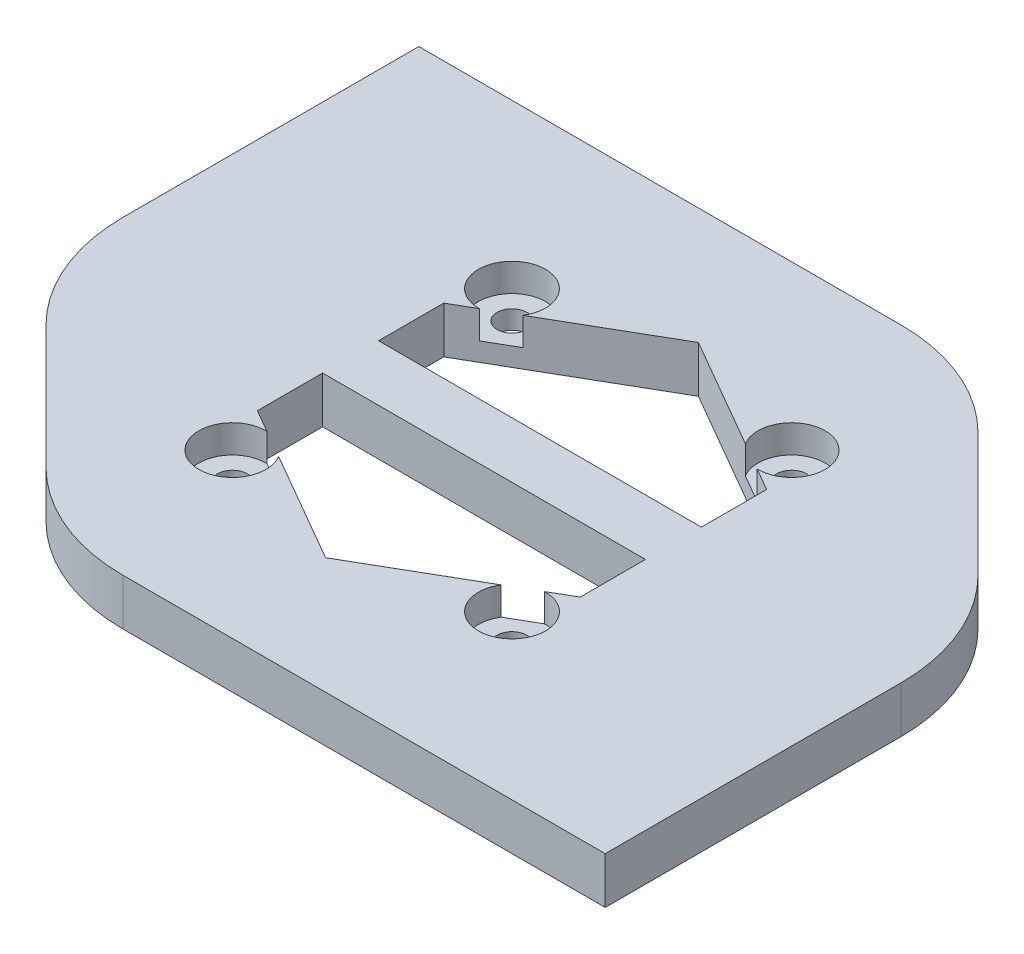
from build123d import *

# Parameters (mm, degrees)
SKETCH1_W           = 85
SKETCH1_H           = 65
BOSS_EXTRUDE1_DEPTH = 5
CUT_EXTRUDE1_DEPTH  = 46
CUT_EXTRUDE2_DEPTH  = 46
SKETCH5_W           = 45.682853102
SKETCH5_H           = 6
BOSS_EXTRUDE3_DEPTH = 5
SKETCH6_R           = 3.6
CUT_EXTRUDE3_DEPTH  = 3
CUT_EXTRUDE4_DEPTH  = 5
FILLET1_R           = 20


with BuildPart() as part:
    # Sketch1 → Boss-Extrude1 (new body)
    with BuildSketch(Plane(origin=(0, 0, 0), x_dir=(1, 0, 0), z_dir=(0, 1, 0))):
        Rectangle(SKETCH1_W, SKETCH1_H)
    extrude(amount=BOSS_EXTRUDE1_DEPTH)

    # Sketch3 → Cut-Extrude1 (cut)
    with BuildSketch(Plane(origin=(0, 5, 0), x_dir=(1, 0, 0), z_dir=(0, 1, 0))):
        with BuildLine():
            ThreePointArc((-13.4, 15), (-16.13137085, 16.13137085), (-15, 13.4))
            Line((-15, 13.4), (-15, 15))
            Line((-15, 15), (-13.4, 15))
        make_face()
        with BuildLine():
            Line((-15, 15), (-15, 13.4))
            ThreePointArc((-15, 13.4), (-13.86862915, 13.86862915), (-13.4, 15))
            Line((-13.4, 15), (-15, 15))
        make_face()
        with BuildLine():
            ThreePointArc((-13.4, 15), (-16.13137085, 16.13137085), (-15, 13.4))
            Line((-15, 13.4), (-15, 15))
            Line((-15, 15), (-13.4, 15))
        make_face()
        with BuildLine():
            Line((-15, 15), (-15, 13.4))
            ThreePointArc((-15, 13.4), (-13.86862915, 13.86862915), (-13.4, 15))
            Line((-13.4, 15), (-15, 15))
        make_face()
        with BuildLine():
            ThreePointArc((13.4, 15), (13.86862915, 13.86862915), (15, 13.4))
            Line((15, 13.4), (15, 15))
            Line((15, 15), (13.4, 15))
        make_face()
        with BuildLine():
            Line((15, 15), (15, 13.4))
            ThreePointArc((15, 13.4), (16.13137085, 13.86862915), (16.6, 15))
            ThreePointArc((16.6, 15), (15, 16.6), (13.4, 15))
            Line((13.4, 15), (15, 15))
        make_face()
        with BuildLine():
            ThreePointArc((13.4, 15), (13.86862915, 13.86862915), (15, 13.4))
            Line((15, 13.4), (15, 15))
            Line((15, 15), (13.4, 15))
        make_face()
        with BuildLine():
            Line((15, 15), (15, 13.4))
            ThreePointArc((15, 13.4), (16.13137085, 13.86862915), (16.6, 15))
            ThreePointArc((16.6, 15), (15, 16.6), (13.4, 15))
            Line((13.4, 15), (15, 15))
        make_face()
        with BuildLine():
            Line((-15, -13.4), (-15, -15))
            Line((-15, -15), (-13.4, -15))
            ThreePointArc((-13.4, -15), (-13.86862915, -13.86862915), (-15, -13.4))
        make_face()
        with BuildLine():
            Line((-13.4, -15), (-15, -15))
            Line((-15, -15), (-15, -13.4))
            ThreePointArc((-15, -13.4), (-16.13137085, -16.13137085), (-13.4, -15))
        make_face()
        with BuildLine():
            Line((-15, -13.4), (-15, -15))
            Line((-15, -15), (-13.4, -15))
            ThreePointArc((-13.4, -15), (-13.86862915, -13.86862915), (-15, -13.4))
        make_face()
        with BuildLine():
            Line((-13.4, -15), (-15, -15))
            Line((-15, -15), (-15, -13.4))
            ThreePointArc((-15, -13.4), (-16.13137085, -16.13137085), (-13.4, -15))
        make_face()
        with BuildLine():
            ThreePointArc((15, -13.4), (13.86862915, -13.86862915), (13.4, -15))
            Line((13.4, -15), (15, -15))
            Line((15, -15), (15, -13.4))
        make_face()
        with BuildLine():
            Line((15, -15), (13.4, -15))
            ThreePointArc((13.4, -15), (15, -16.6), (16.6, -15))
            ThreePointArc((16.6, -15), (16.13137085, -13.86862915), (15, -13.4))
            Line((15, -13.4), (15, -15))
        make_face()
        with BuildLine():
            ThreePointArc((15, -13.4), (13.86862915, -13.86862915), (13.4, -15))
            Line((13.4, -15), (15, -15))
            Line((15, -15), (15, -13.4))
        make_face()
        with BuildLine():
            Line((15, -15), (13.4, -15))
            ThreePointArc((13.4, -15), (15, -16.6), (16.6, -15))
            ThreePointArc((16.6, -15), (16.13137085, -13.86862915), (15, -13.4))
            Line((15, -13.4), (15, -15))
        make_face()
    extrude(amount=-CUT_EXTRUDE1_DEPTH, mode=Mode.SUBTRACT)

    # Sketch4 → Cut-Extrude2 (cut)
    with BuildSketch(Plane(origin=(0, 5, 0), x_dir=(1, 0, 0), z_dir=(0, 1, 0))):
        Polygon((0, -20), (17.320508076, -10), (17.320508076, 10), (0, 20), (-17.320508076, 10), (-17.320508076, -10), align=None)
    extrude(amount=-CUT_EXTRUDE2_DEPTH, mode=Mode.SUBTRACT)

    # Sketch5 → Boss-Extrude3 (add)
    with BuildSketch(Plane(origin=(0, 5, 0), x_dir=(1, 0, 0), z_dir=(0, 1, 0))):
        Rectangle(SKETCH5_W, SKETCH5_H)
    extrude(amount=-BOSS_EXTRUDE3_DEPTH)

    # Sketch6 → Cut-Extrude3 (cut)
    with BuildSketch(Plane(origin=(0, 5, 0), x_dir=(1, 0, 0), z_dir=(0, 1, 0))):
        with Locations((-15, 15)):
            Circle(SKETCH6_R)
        with Locations((15, 15)):
            Circle(SKETCH6_R)
        with Locations((-15, -15)):
            Circle(SKETCH6_R)
        with Locations((15, -15)):
            Circle(SKETCH6_R)
    extrude(amount=-CUT_EXTRUDE3_DEPTH, mode=Mode.SUBTRACT)

    # Sketch7 → Cut-Extrude4 (cut, symmetric)
    with BuildSketch(Plane(origin=(0, 5, 0), x_dir=(1, 0, 0), z_dir=(0, 1, 0))):
        Polygon((17.5, 32.5), (42.5, 7.5), (42.5, 32.5), align=None)
        Polygon((-42.5, -32.5), (-17.5, -32.5), (-42.5, -7.5), align=None)
    extrude(amount=CUT_EXTRUDE4_DEPTH, both=True, mode=Mode.SUBTRACT)

    # Fillet1
    fillet1_edges = [part.edges().sort_by_distance(p)[0] for p in [
        (42.5, 2.5, -7.5),
        (17.5, 2.5, -32.5),
        (-17.5, 2.5, 32.5),
        (-42.5, 2.5, 7.5),
    ]]
    fillet(fillet1_edges, radius=FILLET1_R)


solid = part.part
